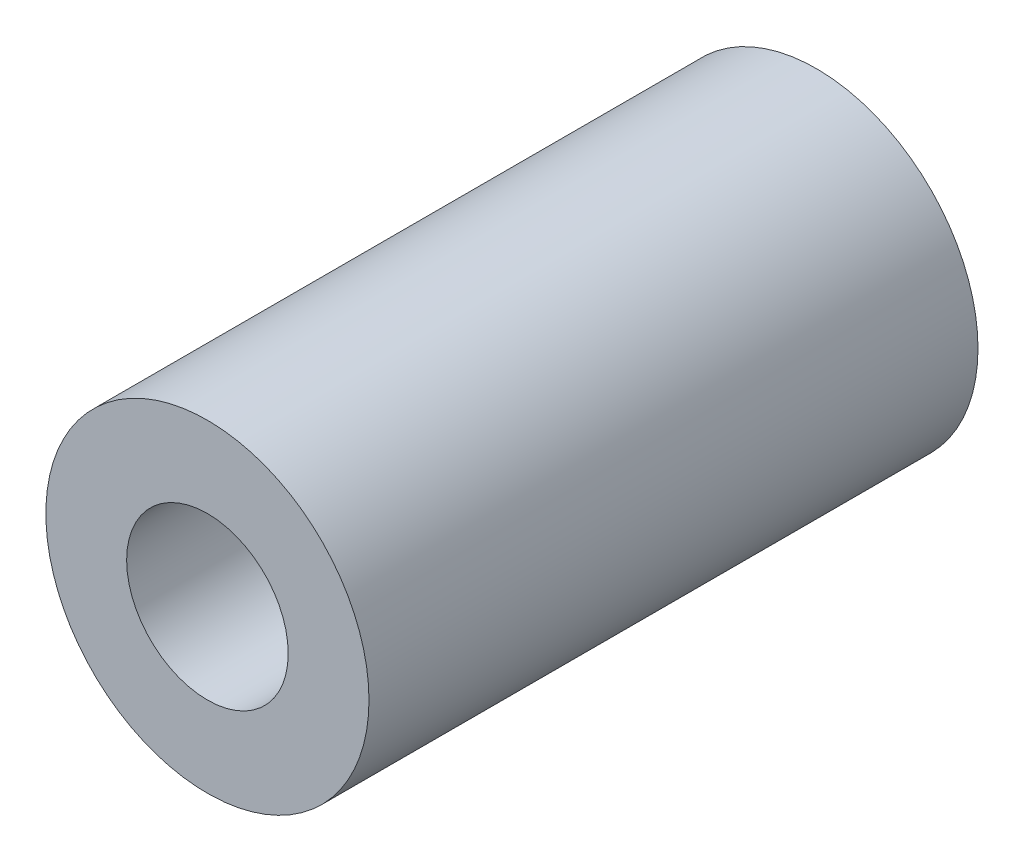
from build123d import *

# Parameters (mm, degrees)
SKETCH1_R      = 13
SKETCH1_R_2    = 6.5
EXTRUDE1_DEPTH = 49


with BuildPart() as part:
    # Sketch1 → Extrude1 (new body)
    with BuildSketch(Plane.XY):
        Circle(SKETCH1_R)
        Circle(SKETCH1_R_2, mode=Mode.SUBTRACT)
    extrude(amount=EXTRUDE1_DEPTH)


solid = part.part
